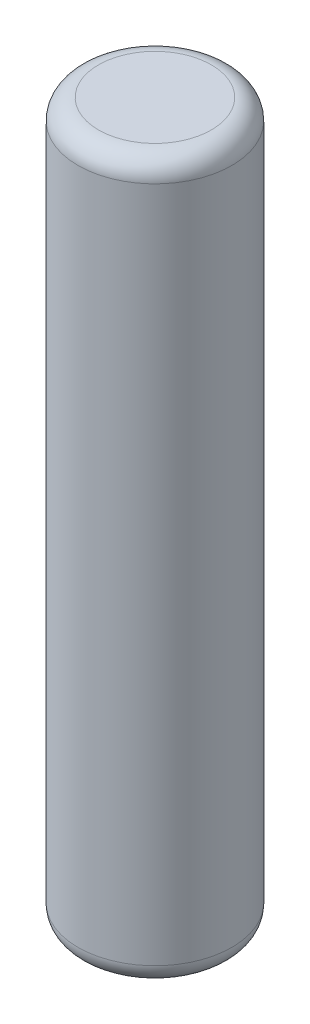
from build123d import *

# Parameters (mm, degrees)
SKETCH_1_R      = 0.375
EXTRUDE_1_DEPTH = 3.5
FILLET_1_R      = 0.1


with BuildPart() as part:
    # Эскиз1 → Бобышка-Вытянуть1 (new body)
    with BuildSketch(Plane(origin=(0, 0, 0), x_dir=(1, 0, 0), z_dir=(0, 1, 0))):
        with Locations(Location((0, 0, 0), (0, 0, 270))):
            Circle(SKETCH_1_R)
    extrude(amount=EXTRUDE_1_DEPTH)

    # Скругление1
    fillet_1_edges = [part.edges().sort_by_distance(p)[0] for p in [
        (0, 0, -0.375),
        (0, 3.5, -0.375),
    ]]
    fillet(fillet_1_edges, radius=FILLET_1_R)


solid = part.part
